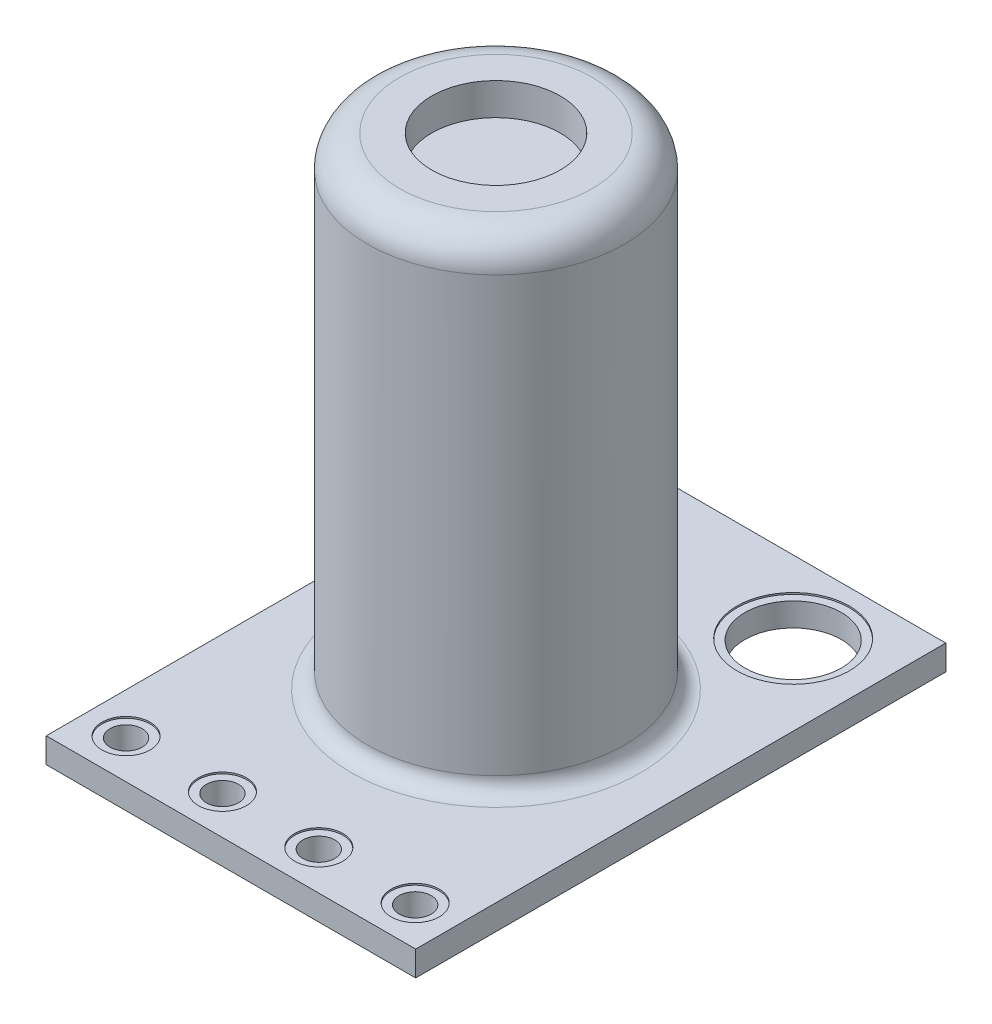
from build123d import *

# Parameters (mm, degrees)
SKETCH1_W           = 11.5
SKETCH1_H           = 16.5
BOSS_EXTRUDE1_DEPTH = 0.78
SKETCH2_R           = 0.5
SKETCH2_R_2         = 1.5
CUT_EXTRUDE1_DEPTH  = 11.086297636
SKETCH2_3_R         = 0.75
SKETCH2_3_R_2       = 0.5
SKETCH2_3_R_3       = 1.75
SKETCH2_3_R_4       = 1.5
CUT_EXTRUDE2_DEPTH  = 0.05
SKETCH4_R           = 4
BOSS_EXTRUDE2_DEPTH = 15
FILLET1_R           = 1
FILLET2_R           = 0.5
SKETCH5_R           = 2
CUT_EXTRUDE3_DEPTH  = 1


with BuildPart() as part:
    # Sketch1 → Boss-Extrude1 (new body)
    with BuildSketch(Plane(origin=(0, 0, 0), x_dir=(1, 0, 0), z_dir=(0, 1, 0))):
        Rectangle(SKETCH1_W, SKETCH1_H)
    extrude(amount=BOSS_EXTRUDE1_DEPTH)

    # Sketch2 → Cut-Extrude1 (cut, through all)
    with BuildSketch(Plane(origin=(0, 0.78, 0), x_dir=(1, 0, 0), z_dir=(0, 1, 0))):
        with Locations((-4.5, -7.015559496)):
            Circle(SKETCH2_R)
        with Locations((-1.5, -7.015559496)):
            Circle(SKETCH2_R)
        with Locations((1.5, -7.015559496)):
            Circle(SKETCH2_R)
        with Locations((4.5, -7.015559496)):
            Circle(SKETCH2_R)
        with Locations((-3.25, 6)):
            Circle(SKETCH2_R_2)
        with Locations((3.25, 6)):
            Circle(SKETCH2_R_2)
    extrude(amount=-CUT_EXTRUDE1_DEPTH, mode=Mode.SUBTRACT)

    # Sketch2<3> → Cut-Extrude2 (cut)
    # profile 1 of 6: a face of its own
    with BuildSketch(Plane(origin=(0, 0.78, 0), x_dir=(1, 0, 0), z_dir=(0, 1, 0))):
        with Locations((-4.5, -7.015559496)):
            Circle(SKETCH2_3_R)
        with Locations((-4.5, -7.015559496)):
            Circle(SKETCH2_3_R_2, mode=Mode.SUBTRACT)
    # profile 2 of 6: a face of its own
    with BuildSketch(Plane(origin=(0, 0.78, 0), x_dir=(1, 0, 0), z_dir=(0, 1, 0))):
        with Locations((-1.5, -7.015559496)):
            Circle(SKETCH2_3_R)
        with Locations((-1.5, -7.015559496)):
            Circle(SKETCH2_3_R_2, mode=Mode.SUBTRACT)
    # profile 3 of 6: a face of its own
    with BuildSketch(Plane(origin=(0, 0.78, 0), x_dir=(1, 0, 0), z_dir=(0, 1, 0))):
        with Locations((4.5, -7.015559496)):
            Circle(SKETCH2_3_R)
        with Locations((4.5, -7.015559496)):
            Circle(SKETCH2_3_R_2, mode=Mode.SUBTRACT)
    # profile 4 of 6: a face of its own
    with BuildSketch(Plane(origin=(0, 0.78, 0), x_dir=(1, 0, 0), z_dir=(0, 1, 0))):
        with Locations((1.5, -7.015559496)):
            Circle(SKETCH2_3_R)
        with Locations((1.5, -7.015559496)):
            Circle(SKETCH2_3_R_2, mode=Mode.SUBTRACT)
    # profile 5 of 6: a face of its own
    with BuildSketch(Plane(origin=(0, 0.78, 0), x_dir=(1, 0, 0), z_dir=(0, 1, 0))):
        with Locations((-3.25, 6)):
            Circle(SKETCH2_3_R_3)
        with Locations((-3.25, 6)):
            Circle(SKETCH2_3_R_4, mode=Mode.SUBTRACT)
    # profile 6 of 6: a face of its own
    with BuildSketch(Plane(origin=(0, 0.78, 0), x_dir=(1, 0, 0), z_dir=(0, 1, 0))):
        with Locations((3.25, 6)):
            Circle(SKETCH2_3_R_3)
        with Locations((3.25, 6)):
            Circle(SKETCH2_3_R_4, mode=Mode.SUBTRACT)
    extrude(amount=-CUT_EXTRUDE2_DEPTH, mode=Mode.SUBTRACT)

    # Sketch4 → Boss-Extrude2 (add)
    with BuildSketch(Plane(origin=(0, 0.78, 0), x_dir=(1, 0, 0), z_dir=(0, 1, 0))):
        Circle(SKETCH4_R)
    extrude(amount=BOSS_EXTRUDE2_DEPTH)

    # Fillet1
    fillet1_edges = [part.edges().sort_by_distance(p)[0] for p in [
        (-4, 15.78, 0),
    ]]
    fillet(fillet1_edges, radius=FILLET1_R)

    # Fillet2
    fillet2_edges = [part.edges().sort_by_distance(p)[0] for p in [
        (-4, 0.78, 0),
    ]]
    fillet(fillet2_edges, radius=FILLET2_R)

    # Sketch5 → Cut-Extrude3 (cut)
    with BuildSketch(Plane(origin=(0, 15.78, 0), x_dir=(1, 0, 0), z_dir=(0, 1, 0))):
        Circle(SKETCH5_R)
    extrude(amount=-CUT_EXTRUDE3_DEPTH, mode=Mode.SUBTRACT)


solid = part.part
